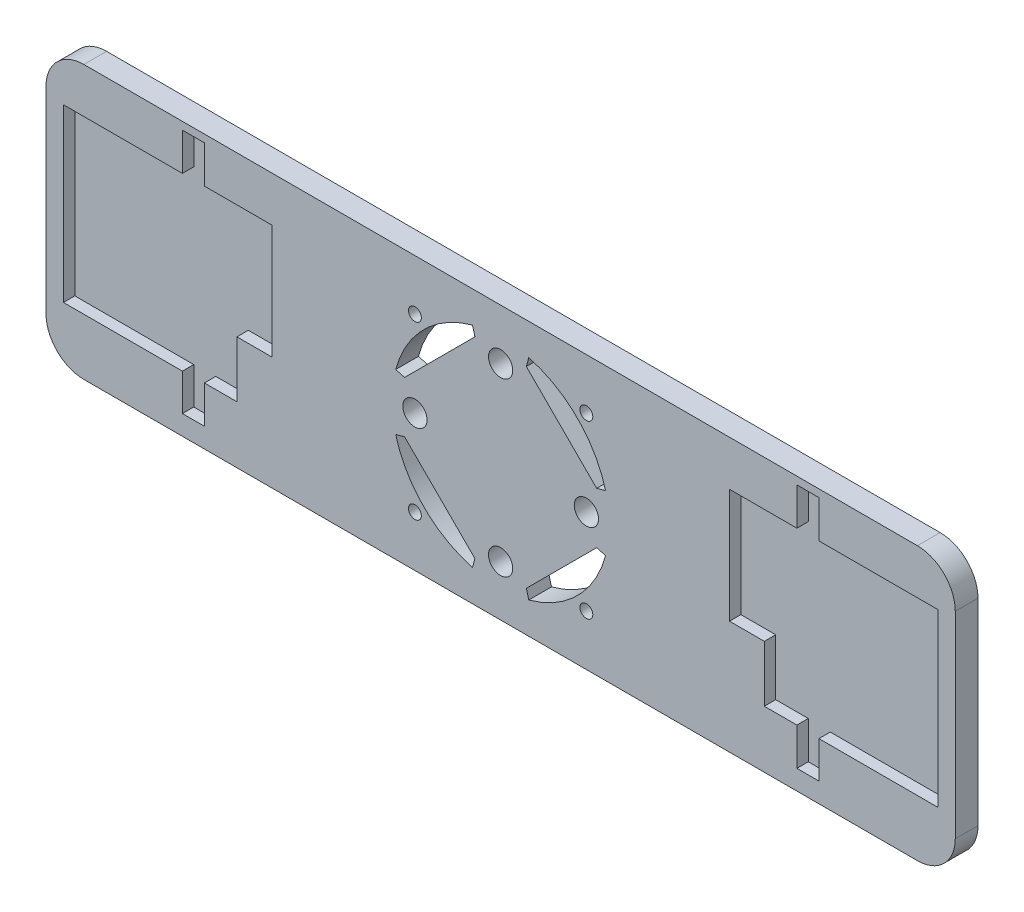
from build123d import *

# Parameters (mm, degrees)
SKETCH_1_W          = 120
SKETCH_1_H          = 36
SKETCH_1_R          = 0.85
SKETCH_1_R_2        = 1.6
EXTRUDE_1_DEPTH     = 3
CUT_EXTRUDE_1_DEPTH = 1.5
FILLET_1_R          = 5


with BuildPart() as part:
    # 草图1 → 凸台-拉伸1 (new body)
    with BuildSketch(Plane.XY):
        with Locations((60, 18)):
            Rectangle(SKETCH_1_W, SKETCH_1_H)
        with Locations((48.686291501, 29.313708499)):
            Circle(SKETCH_1_R, mode=Mode.SUBTRACT)
        with Locations((48.686291501, 6.686291501)):
            Circle(SKETCH_1_R, mode=Mode.SUBTRACT)
        with Locations(Location((71.313708499, 6.686291501, 0), (0, 0, 180))):
            Circle(SKETCH_1_R, mode=Mode.SUBTRACT)
        with Locations(Location((71.313708499, 29.313708499, 0), (0, 0, 180))):
            Circle(SKETCH_1_R, mode=Mode.SUBTRACT)
        with Locations((60, 29.313708499)):
            Circle(SKETCH_1_R_2, mode=Mode.SUBTRACT)
        with Locations(Location((48.686291501, 18, 0), (0, 0, 180))):
            Circle(SKETCH_1_R_2, mode=Mode.SUBTRACT)
        with Locations((60, 6.686291501)):
            Circle(SKETCH_1_R_2, mode=Mode.SUBTRACT)
        with Locations(Location((71.313708499, 18, 0), (0, 0, 180))):
            Circle(SKETCH_1_R_2, mode=Mode.SUBTRACT)
        with BuildLine():
            Line((56.604710662, 30.671392317), (56.28868628, 31.850811367))
            ThreePointArc((56.28868628, 31.850811367), (49.860502354, 28.139497646), (46.149188633, 21.71131372))
            Line((46.149188633, 21.71131372), (47.328607683, 21.395289338))
            Line((47.328607683, 21.395289338), (56.604710662, 30.671392317))
        make_face(mode=Mode.SUBTRACT)
        with BuildLine():
            Line((63.395289338, 30.671392317), (63.71131372, 31.850811367))
            ThreePointArc((63.71131372, 31.850811367), (70.139497646, 28.139497646), (73.850811367, 21.71131372))
            Line((73.850811367, 21.71131372), (72.671392317, 21.395289338))
            Line((72.671392317, 21.395289338), (63.395289338, 30.671392317))
        make_face(mode=Mode.SUBTRACT)
        with BuildLine():
            Line((63.395289338, 5.328607683), (63.71131372, 4.149188633))
            ThreePointArc((63.71131372, 4.149188633), (70.139497646, 7.860502354), (73.850811367, 14.28868628))
            Line((73.850811367, 14.28868628), (72.671392317, 14.604710662))
            Line((72.671392317, 14.604710662), (63.395289338, 5.328607683))
        make_face(mode=Mode.SUBTRACT)
        with BuildLine():
            Line((47.328607683, 14.604710662), (46.149188633, 14.28868628))
            ThreePointArc((46.149188633, 14.28868628), (49.860502354, 7.860502354), (56.28868628, 4.149188633))
            Line((56.28868628, 4.149188633), (56.604710662, 5.328607683))
            Line((56.604710662, 5.328607683), (47.328607683, 14.604710662))
        make_face(mode=Mode.SUBTRACT)
    extrude(amount=EXTRUDE_1_DEPTH)

    # 草图2 → 切除-拉伸1 (cut)
    with BuildSketch(Plane.XY.offset(3)):
        Polygon((2.3, 30.05), (18, 30.05), (18, 35), (20.9, 35), (20.9, 30.05), (29.8, 30.05), (29.8, 14.97), (25.2, 14.97), (25.2, 7.55), (20.9, 7.55), (20.9, 2.6), (18, 2.6), (18, 7.45), (2.3, 7.45), align=None)
        Polygon((117.7, 30.05), (102, 30.05), (102, 35), (99.1, 35), (99.1, 30.05), (90.2, 30.05), (90.2, 14.97), (94.8, 14.97), (94.8, 7.55), (99.1, 7.55), (99.1, 2.6), (102, 2.6), (102, 7.45), (117.7, 7.45), align=None)
    extrude(amount=-CUT_EXTRUDE_1_DEPTH, mode=Mode.SUBTRACT)

    # 圆角1
    fillet_1_edges = [part.edges().sort_by_distance(p)[0] for p in [
        (0, 36, 1.5),
        (120, 36, 1.5),
        (120, 0, 1.5),
        (0, 0, 1.5),
    ]]
    fillet(fillet_1_edges, radius=FILLET_1_R)


solid = part.part
